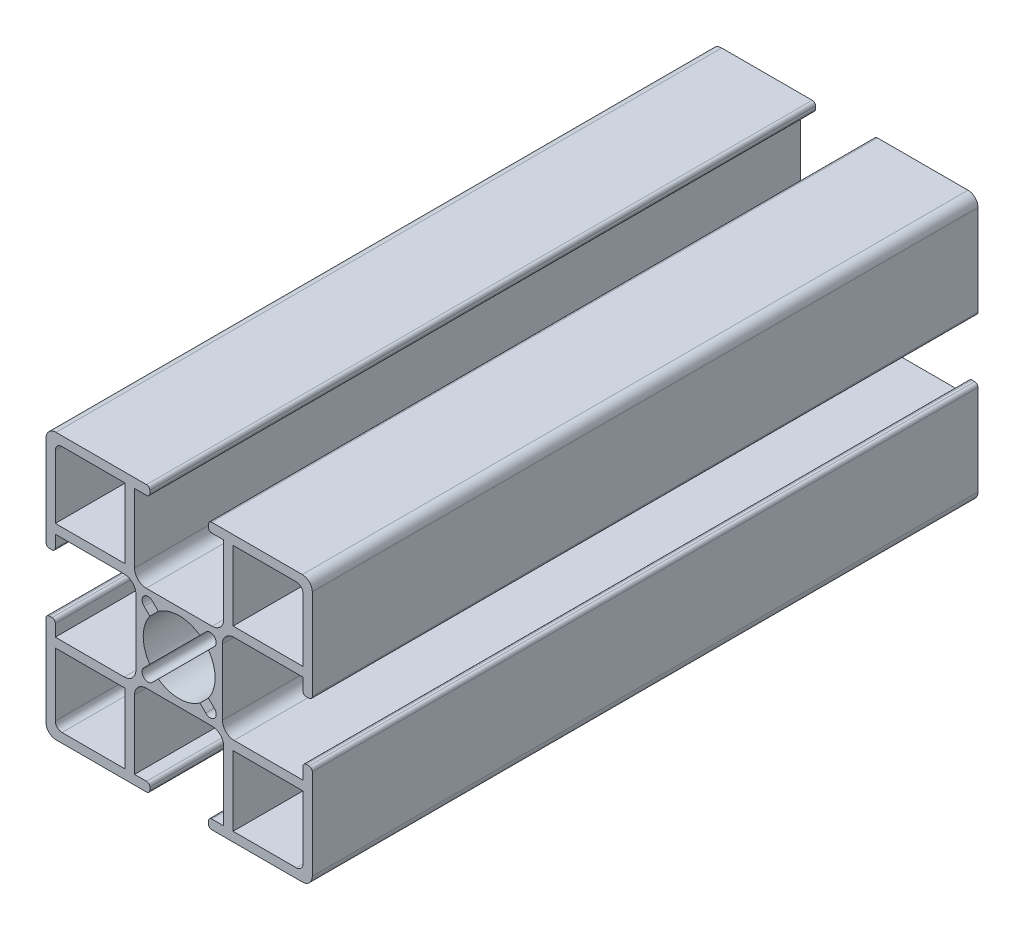
from build123d import *

# Parameters (mm, degrees)
EXTRUDE_1_DEPTH = 100


with BuildPart() as part:
    # 草图1 → 凸台-拉伸1 (new body)
    with BuildSketch(Plane.XY):
        with BuildLine():
            Line((-18.780003001, 7.154207574), (-18.780003001, 5.354207574))
            ThreePointArc((-18.780003001, 5.354207574), (-18.926449611, 5.000654183), (-19.280003001, 4.854207574))
            Line((-19.280003001, 4.854207574), (-19.680003001, 4.854207574))
            ThreePointArc((-19.680003001, 4.854207574), (-20.033556392, 5.000654183), (-20.180003001, 5.354207574))
            Line((-20.180003001, 5.354207574), (-20.180003001, 18.954207574))
            ThreePointArc((-20.180003001, 18.954207574), (-19.740663173, 20.014867745), (-18.680003001, 20.454207574))
            Line((-18.680003001, 20.454207574), (-5.080003001, 20.454207574))
            ThreePointArc((-5.080003001, 20.454207574), (-4.726449611, 20.307760964), (-4.580003001, 19.954207574))
            Line((-4.580003001, 19.954207574), (-4.580003001, 19.554207574))
            ThreePointArc((-4.580003001, 19.554207574), (-4.726449611, 19.200654183), (-5.080003001, 19.054207574))
            Line((-5.080003001, 19.054207574), (-6.880003001, 19.054207574))
            Line((-6.880003001, 19.054207574), (-6.880003001, 8.704207574))
            ThreePointArc((-6.880003001, 8.704207574), (-6.367439869, 7.466770707), (-5.130003001, 6.954207574))
            Line((-5.130003001, 6.954207574), (4.769996999, 6.954207574))
            ThreePointArc((4.769996999, 6.954207574), (6.007433866, 7.466770707), (6.519996999, 8.704207574))
            Line((6.519996999, 8.704207574), (6.519996999, 19.054207574))
            Line((6.519996999, 19.054207574), (4.719996999, 19.054207574))
            ThreePointArc((4.719996999, 19.054207574), (4.366443608, 19.200654183), (4.219996999, 19.554207574))
            Line((4.219996999, 19.554207574), (4.219996999, 19.954207574))
            ThreePointArc((4.219996999, 19.954207574), (4.366443608, 20.307760964), (4.719996999, 20.454207574))
            Line((4.719996999, 20.454207574), (18.319996999, 20.454207574))
            ThreePointArc((18.319996999, 20.454207574), (19.38065717, 20.014867745), (19.819996999, 18.954207574))
            Line((19.819996999, 18.954207574), (19.819996999, 5.354207574))
            ThreePointArc((19.819996999, 5.354207574), (19.673550389, 5.000654183), (19.319996999, 4.854207574))
            Line((19.319996999, 4.854207574), (18.919996999, 4.854207574))
            ThreePointArc((18.919996999, 4.854207574), (18.566443608, 5.000654183), (18.419996999, 5.354207574))
            Line((18.419996999, 5.354207574), (18.419996999, 7.154207574))
            Line((18.419996999, 7.154207574), (8.069996999, 7.154207574))
            ThreePointArc((8.069996999, 7.154207574), (6.832560131, 6.641644441), (6.319996999, 5.404207574))
            Line((6.319996999, 5.404207574), (6.319996999, -4.495792426))
            ThreePointArc((6.319996999, -4.495792426), (6.832560131, -5.733229293), (8.069996999, -6.245792426))
            Line((8.069996999, -6.245792426), (18.419996999, -6.245792426))
            Line((18.419996999, -6.245792426), (18.419996999, -4.445792426))
            ThreePointArc((18.419996999, -4.445792426), (18.566443608, -4.092239036), (18.919996999, -3.945792426))
            Line((18.919996999, -3.945792426), (19.319996999, -3.945792426))
            ThreePointArc((19.319996999, -3.945792426), (19.673550389, -4.092239036), (19.819996999, -4.445792426))
            Line((19.819996999, -4.445792426), (19.819996999, -18.045792426))
            ThreePointArc((19.819996999, -18.045792426), (19.38065717, -19.106452598), (18.319996999, -19.545792426))
            Line((18.319996999, -19.545792426), (4.719996999, -19.545792426))
            ThreePointArc((4.719996999, -19.545792426), (4.366443608, -19.399345817), (4.219996999, -19.045792426))
            Line((4.219996999, -19.045792426), (4.219996999, -18.645792426))
            ThreePointArc((4.219996999, -18.645792426), (4.366443608, -18.292239036), (4.719996999, -18.145792426))
            Line((4.719996999, -18.145792426), (6.519996999, -18.145792426))
            Line((6.519996999, -18.145792426), (6.519996999, -7.795792426))
            ThreePointArc((6.519996999, -7.795792426), (6.007433866, -6.558355559), (4.769996999, -6.045792426))
            Line((4.769996999, -6.045792426), (-5.130003001, -6.045792426))
            ThreePointArc((-5.130003001, -6.045792426), (-6.367439869, -6.558355559), (-6.880003001, -7.795792426))
            Line((-6.880003001, -7.795792426), (-6.880003001, -18.145792426))
            Line((-6.880003001, -18.145792426), (-5.080003001, -18.145792426))
            ThreePointArc((-5.080003001, -18.145792426), (-4.726449611, -18.292239036), (-4.580003001, -18.645792426))
            Line((-4.580003001, -18.645792426), (-4.580003001, -19.045792426))
            ThreePointArc((-4.580003001, -19.045792426), (-4.726449611, -19.399345817), (-5.080003001, -19.545792426))
            Line((-5.080003001, -19.545792426), (-18.680003001, -19.545792426))
            ThreePointArc((-18.680003001, -19.545792426), (-19.740663173, -19.106452598), (-20.180003001, -18.045792426))
            Line((-20.180003001, -18.045792426), (-20.180003001, -4.445792426))
            ThreePointArc((-20.180003001, -4.445792426), (-20.033556392, -4.092239036), (-19.680003001, -3.945792426))
            Line((-19.680003001, -3.945792426), (-19.280003001, -3.945792426))
            ThreePointArc((-19.280003001, -3.945792426), (-18.926449611, -4.092239036), (-18.780003001, -4.445792426))
            Line((-18.780003001, -4.445792426), (-18.780003001, -6.245792426))
            Line((-18.780003001, -6.245792426), (-8.430003001, -6.245792426))
            ThreePointArc((-8.430003001, -6.245792426), (-7.192566134, -5.733229293), (-6.680003001, -4.495792426))
            Line((-6.680003001, -4.495792426), (-6.680003001, 5.404207574))
            ThreePointArc((-6.680003001, 5.404207574), (-7.192566134, 6.641644441), (-8.430003001, 7.154207574))
            Line((-8.430003001, 7.154207574), (-18.780003001, 7.154207574))
        make_face()
        with BuildLine():
            Line((-8.280003001, 19.054207574), (-17.780003001, 19.054207574))
            ThreePointArc((-17.780003001, 19.054207574), (-18.487109783, 18.761314355), (-18.780003001, 18.054207574))
            Line((-18.780003001, 18.054207574), (-18.780003001, 8.554207574))
            Line((-18.780003001, 8.554207574), (-8.280003001, 8.554207574))
            Line((-8.280003001, 8.554207574), (-8.280003001, 19.054207574))
        make_face(mode=Mode.SUBTRACT)
        with BuildLine():
            Line((-4.581369224, 3.58278159), (-5.443828842, 4.445241208))
            ThreePointArc((-5.443828842, 4.445241208), (-5.48330386, 5.757508433), (-4.171036636, 5.718033415))
            Line((-4.171036636, 5.718033415), (-3.308577018, 4.855573796))
            ThreePointArc((-3.308577018, 4.855573796), (-0.180003001, 5.854207574), (2.948571015, 4.855573796))
            Line((2.948571015, 4.855573796), (3.887675086, 5.794677867))
            ThreePointArc((3.887675086, 5.794677867), (5.160467292, 5.718033415), (5.083822839, 4.445241208))
            Line((5.083822839, 4.445241208), (4.221363221, 3.58278159))
            ThreePointArc((4.221363221, 3.58278159), (5.219996999, 0.454207574), (4.221363221, -2.674366443))
            Line((4.221363221, -2.674366443), (5.083822839, -3.536826061))
            ThreePointArc((5.083822839, -3.536826061), (5.123297857, -4.849093285), (3.811030633, -4.809618267))
            Line((3.811030633, -4.809618267), (2.948571015, -3.947158649))
            ThreePointArc((2.948571015, -3.947158649), (-0.180003001, -4.945792426), (-3.308577018, -3.947158649))
            Line((-3.308577018, -3.947158649), (-4.171036636, -4.809618267))
            ThreePointArc((-4.171036636, -4.809618267), (-5.48330386, -4.849093285), (-5.443828842, -3.536826061))
            Line((-5.443828842, -3.536826061), (-4.581369224, -2.674366443))
            ThreePointArc((-4.581369224, -2.674366443), (-5.580003001, 0.454207574), (-4.581369224, 3.58278159))
        make_face(mode=Mode.SUBTRACT)
        with BuildLine():
            Line((7.919996999, 19.054207574), (17.419996999, 19.054207574))
            ThreePointArc((17.419996999, 19.054207574), (18.12710378, 18.761314355), (18.419996999, 18.054207574))
            Line((18.419996999, 18.054207574), (18.419996999, 8.554207574))
            Line((18.419996999, 8.554207574), (7.919996999, 8.554207574))
            Line((7.919996999, 8.554207574), (7.919996999, 19.054207574))
        make_face(mode=Mode.SUBTRACT)
        with BuildLine():
            Line((-8.280003001, -18.145792426), (-17.780003001, -18.145792426))
            ThreePointArc((-17.780003001, -18.145792426), (-18.487109783, -17.852899208), (-18.780003001, -17.145792426))
            Line((-18.780003001, -17.145792426), (-18.780003001, -7.645792426))
            Line((-18.780003001, -7.645792426), (-8.280003001, -7.645792426))
            Line((-8.280003001, -7.645792426), (-8.280003001, -18.145792426))
        make_face(mode=Mode.SUBTRACT)
        with BuildLine():
            Line((7.919996999, -18.145792426), (17.419996999, -18.145792426))
            ThreePointArc((17.419996999, -18.145792426), (18.12710378, -17.852899208), (18.419996999, -17.145792426))
            Line((18.419996999, -17.145792426), (18.419996999, -7.645792426))
            Line((18.419996999, -7.645792426), (7.919996999, -7.645792426))
            Line((7.919996999, -7.645792426), (7.919996999, -18.145792426))
        make_face(mode=Mode.SUBTRACT)
    extrude(amount=EXTRUDE_1_DEPTH)


solid = part.part
